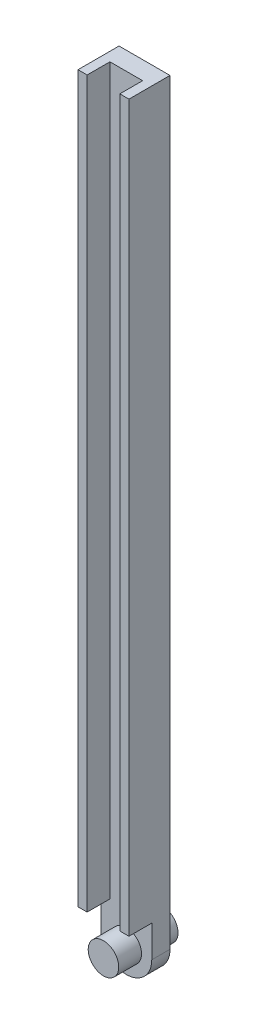
from build123d import *

# Parameters (mm, degrees)
SKETCH1_R      = 42.514793855
EXTRUDE1_DEPTH = 50.8
SKETCH1_4_W    = 25.4
SKETCH1_4_H    = 2018.826997117
EXTRUDE2_DEPTH = 114.3
EXTRUDE3_START = 50.8
SKETCH2_R      = 42.514793855
EXTRUDE3_DEPTH = 165.1


with BuildPart() as part:
    # Sketch1 → Extrude1 (new body)
    with BuildSketch(Plane.XY):
        with BuildLine():
            Line((-1183.595391403, 1195.645715897), (-1274.700151443, 1195.645715897))
            Line((-1274.700151443, 1195.645715897), (-1274.700151443, -823.18128122))
            Line((-1274.700151443, -823.18128122), (-1300.100151443, -823.18128122))
            Line((-1300.100151443, -823.18128122), (-1300.100151443, -911.736177467))
            ThreePointArc((-1300.100151443, -911.736177467), (-1229.147771423, -982.688557487), (-1158.195391403, -911.736177467))
            Line((-1158.195391403, -911.736177467), (-1158.195391403, -823.18128122))
            Line((-1158.195391403, -823.18128122), (-1183.595391403, -823.18128122))
            Line((-1183.595391403, -823.18128122), (-1183.595391403, 1195.645715897))
        make_face()
        with Locations((-1229.147771423, -911.736177467)):
            Circle(SKETCH1_R, mode=Mode.SUBTRACT)
    extrude(amount=EXTRUDE1_DEPTH)

    # Sketch1<4> → Extrude2 (add)
    with BuildSketch(Plane.XY):
        with Locations((-1287.400151443, 186.232217339)):
            Rectangle(SKETCH1_4_W, SKETCH1_4_H)
        with Locations((-1170.895391403, 186.232217339)):
            Rectangle(SKETCH1_4_W, SKETCH1_4_H)
    extrude(amount=EXTRUDE2_DEPTH)

    # Sketch2 → Extrude3 (add)
    with BuildSketch(Plane(origin=(0, 0, 0), x_dir=(-1, 0, 0), z_dir=(0, 0, -1)).offset(EXTRUDE3_START)):
        with Locations((1229.147771423, -911.736177467)):
            Circle(SKETCH2_R)
    extrude(amount=-EXTRUDE3_DEPTH)


solid = part.part
